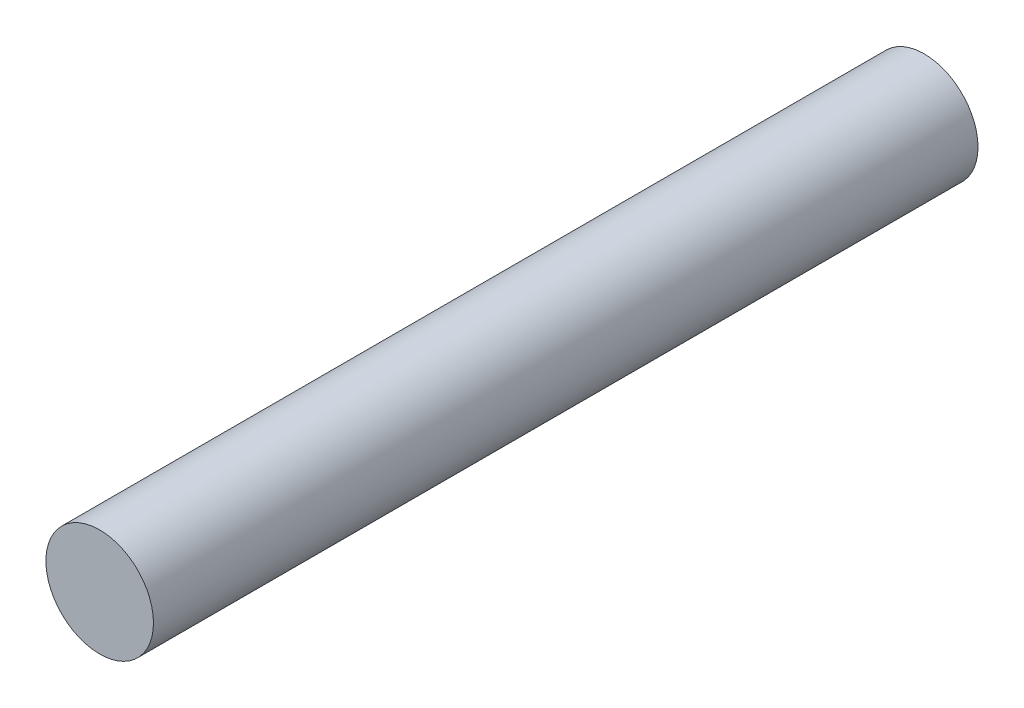
from build123d import *

# Parameters (mm, degrees)
CROQUIS1_R              = 6
SALIENTE_EXTRUIR1_DEPTH = 92


with BuildPart() as part:
    # Croquis1 → Saliente-Extruir1 (new body)
    with BuildSketch(Plane.XY):
        Circle(CROQUIS1_R)
    extrude(amount=SALIENTE_EXTRUIR1_DEPTH)


solid = part.part
